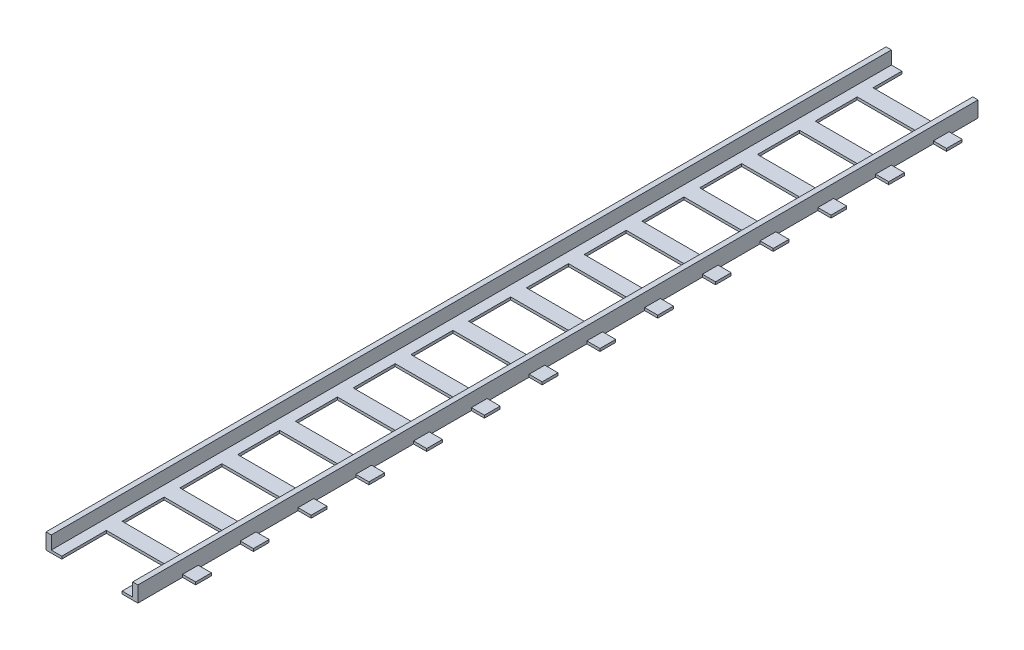
from build123d import *

# Parameters (mm, degrees)
BOSS_EXTRUDE1_DEPTH   = 320
BOSS_EXTRUDE1_2_DEPTH = 320
SKETCH3_W             = 45
SKETCH3_H             = 6
BOSS_EXTRUDE2_DEPTH   = 1


with BuildPart() as part:
    # Sketch1 → Boss-Extrude1 (new body)
    with BuildSketch(Plane.XY):
        Polygon((-17.5, 0), (-17.5, 6), (-15.5, 6), (-15.5, 1), (-11.5, 1), (-11.5, 0), align=None)
    extrude(amount=BOSS_EXTRUDE1_DEPTH)



with BuildPart() as body_2:
    # Sketch1 → Boss-Extrude1 2 (new body)
    with BuildSketch(Plane.XY):
        Polygon((17.5, 0), (17.5, 6), (15.5, 6), (15.5, 1), (11.5, 1), (11.5, 0), align=None)
    extrude(amount=BOSS_EXTRUDE1_2_DEPTH)


with BuildPart() as part_1:
    add(part.part)

    add(body_2.part)  # Boss-Extrude2 merges body 2
    # Sketch3 → Boss-Extrude2 (add)
    with BuildSketch(Plane(origin=(0, 0, 0), x_dir=(1, 0, 0), z_dir=(0, 1, 0))):
        with Locations((0, -14)):
            Rectangle(SKETCH3_W, SKETCH3_H)
        with Locations((0, -36)):
            Rectangle(SKETCH3_W, SKETCH3_H)
        with Locations((0, -58)):
            Rectangle(SKETCH3_W, SKETCH3_H)
        with Locations((0, -80)):
            Rectangle(SKETCH3_W, SKETCH3_H)
        with Locations((0, -102)):
            Rectangle(SKETCH3_W, SKETCH3_H)
        with Locations((0, -124)):
            Rectangle(SKETCH3_W, SKETCH3_H)
        with Locations((0, -146)):
            Rectangle(SKETCH3_W, SKETCH3_H)
        with Locations((0, -168)):
            Rectangle(SKETCH3_W, SKETCH3_H)
        with Locations((0, -190)):
            Rectangle(SKETCH3_W, SKETCH3_H)
        with Locations((0, -212)):
            Rectangle(SKETCH3_W, SKETCH3_H)
        with Locations((0, -234)):
            Rectangle(SKETCH3_W, SKETCH3_H)
        with Locations((0, -256)):
            Rectangle(SKETCH3_W, SKETCH3_H)
        with Locations((0, -278)):
            Rectangle(SKETCH3_W, SKETCH3_H)
        with Locations((0, -300)):
            Rectangle(SKETCH3_W, SKETCH3_H)
    extrude(amount=BOSS_EXTRUDE2_DEPTH)


solid = part_1.part
